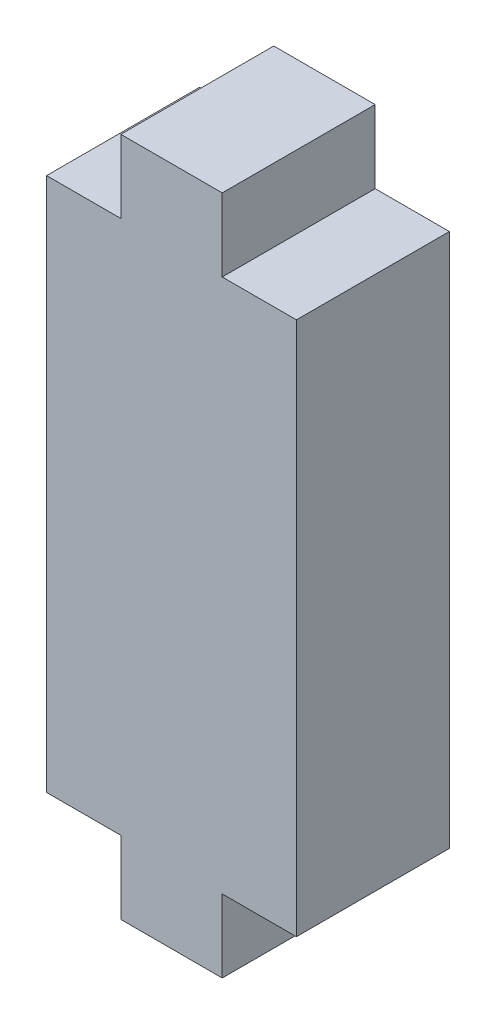
from build123d import *

# Parameters (mm, degrees)
BOSS_EXTRUDE1_DEPTH = 10


with BuildPart() as part:
    # Sketch1 → Boss-Extrude1 (new body)
    with BuildSketch(Plane.XY):
        Polygon((4.8514, 0), (11.4808, 0), (11.4808, 4.7625), (16.3322, 4.7625), (16.3322, 39.6875), (11.4808, 39.6875), (11.4808, 44.45), (4.8514, 44.45), (4.8514, 39.6875), (0, 39.6875), (0, 4.7625), (4.8514, 4.7625), align=None)
    extrude(amount=BOSS_EXTRUDE1_DEPTH)


solid = part.part
